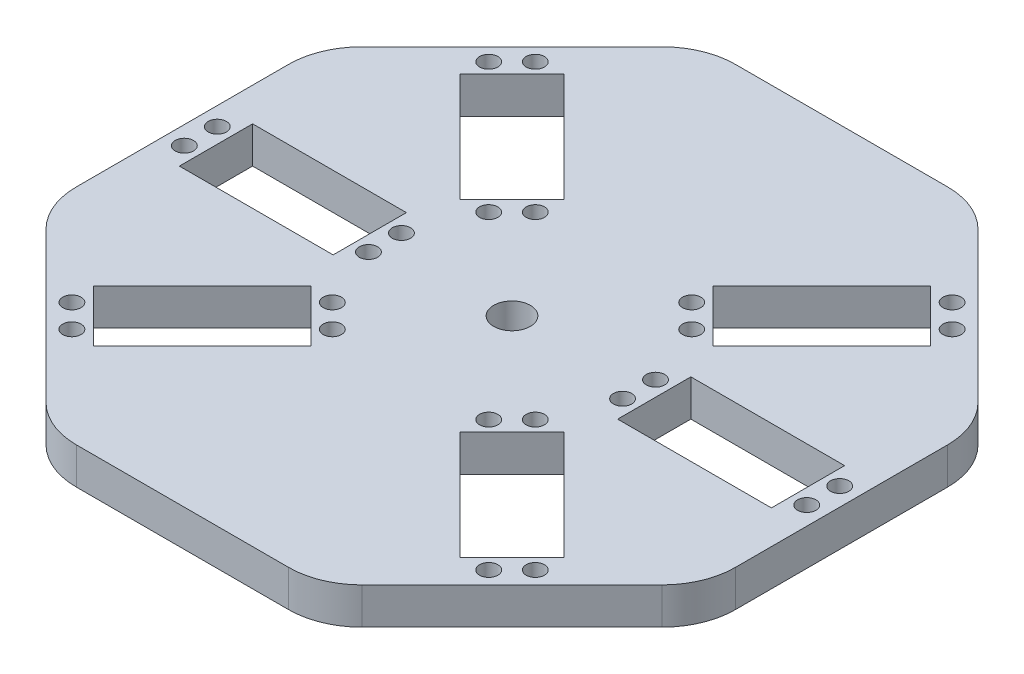
from build123d import *

# Parameters (mm, degrees)
SKETCH1_R           = 2.5
SKETCH1_W           = 42
SKETCH1_H           = 20
BOSS_EXTRUDE1_DEPTH = 10
FILLET1_R           = 20
SKETCH2_R           = 5
CUT_EXTRUDE1_DEPTH  = 128.671453348


with BuildPart() as part:
    # Sketch1 → Boss-Extrude1 (new body)
    with BuildSketch(Plane(origin=(0, 0, 0), x_dir=(1, 0, 0), z_dir=(0, 1, 0))):
        Polygon((-90, -37.279220614), (-37.279220614, -90), (37.279220614, -90), (90, -37.279220614), (90, 37.279220614), (37.279220614, 90), (-37.279220614, 90), (-90, 37.279220614), align=None)
        with Locations(Location((56.922095886, -63.286056916, 0), (0, 0, 270))):
            Circle(SKETCH1_R, mode=Mode.SUBTRACT)
        with Locations(Location((63.286056916, -56.922095886, 0), (0, 0, 270))):
            Circle(SKETCH1_R, mode=Mode.SUBTRACT)
        with Locations(Location((27.718585823, -21.354624792, 0), (0, 0, 270))):
            Circle(SKETCH1_R, mode=Mode.SUBTRACT)
        with Locations(Location((21.354624792, -27.718585823, 0), (0, 0, 270))):
            Circle(SKETCH1_R, mode=Mode.SUBTRACT)
        with Locations(Location((-27.718585823, -21.354624792, 0), (0, 0, 270))):
            Circle(SKETCH1_R, mode=Mode.SUBTRACT)
        with Locations(Location((-21.354624792, -27.718585823, 0), (0, 0, 270))):
            Circle(SKETCH1_R, mode=Mode.SUBTRACT)
        with Locations(Location((-56.922095886, -63.286056916, 0), (0, 0, 270))):
            Circle(SKETCH1_R, mode=Mode.SUBTRACT)
        with Locations(Location((-63.286056916, -56.922095886, 0), (0, 0, 270))):
            Circle(SKETCH1_R, mode=Mode.SUBTRACT)
        with Locations(Location((-34.7, 4.5, 0), (0, 0, 270))):
            Circle(SKETCH1_R, mode=Mode.SUBTRACT)
        with Locations(Location((-34.7, -4.5, 0), (0, 0, 270))):
            Circle(SKETCH1_R, mode=Mode.SUBTRACT)
        with Locations(Location((-85, -4.5, 0), (0, 0, 270))):
            Circle(SKETCH1_R, mode=Mode.SUBTRACT)
        with Locations(Location((-85, 4.5, 0), (0, 0, 270))):
            Circle(SKETCH1_R, mode=Mode.SUBTRACT)
        with Locations(Location((-21.354624792, 27.718585823, 0), (0, 0, 270))):
            Circle(SKETCH1_R, mode=Mode.SUBTRACT)
        with Locations(Location((-27.718585823, 21.354624792, 0), (0, 0, 270))):
            Circle(SKETCH1_R, mode=Mode.SUBTRACT)
        with Locations(Location((-63.286056916, 56.922095886, 0), (0, 0, 270))):
            Circle(SKETCH1_R, mode=Mode.SUBTRACT)
        with Locations(Location((-56.922095886, 63.286056916, 0), (0, 0, 270))):
            Circle(SKETCH1_R, mode=Mode.SUBTRACT)
        with Locations(Location((27.718585823, 21.354624792, 0), (0, 0, 270))):
            Circle(SKETCH1_R, mode=Mode.SUBTRACT)
        with Locations(Location((21.354624792, 27.718585823, 0), (0, 0, 270))):
            Circle(SKETCH1_R, mode=Mode.SUBTRACT)
        with Locations(Location((56.922095886, 63.286056916, 0), (0, 0, 270))):
            Circle(SKETCH1_R, mode=Mode.SUBTRACT)
        with Locations(Location((63.286056916, 56.922095886, 0), (0, 0, 270))):
            Circle(SKETCH1_R, mode=Mode.SUBTRACT)
        with Locations(Location((34.7, -4.5, 0), (0, 0, 270))):
            Circle(SKETCH1_R, mode=Mode.SUBTRACT)
        with Locations(Location((34.7, 4.5, 0), (0, 0, 270))):
            Circle(SKETCH1_R, mode=Mode.SUBTRACT)
        with Locations(Location((85, 4.5, 0), (0, 0, 270))):
            Circle(SKETCH1_R, mode=Mode.SUBTRACT)
        with Locations(Location((85, -4.5, 0), (0, 0, 270))):
            Circle(SKETCH1_R, mode=Mode.SUBTRACT)
        Polygon((34.542166261, -20.400030637), (20.400030637, -34.542166261), (50.098515447, -64.240651071), (64.240651071, -50.098515447), align=None, mode=Mode.SUBTRACT)
        Polygon((-20.400030637, -34.542166261), (-34.542166261, -20.400030637), (-64.240651071, -50.098515447), (-50.098515447, -64.240651071), align=None, mode=Mode.SUBTRACT)
        with Locations((-59.85, 0)):
            Rectangle(SKETCH1_W, SKETCH1_H, mode=Mode.SUBTRACT)
        Polygon((-34.542166261, 20.400030637), (-20.400030637, 34.542166261), (-50.098515447, 64.240651071), (-64.240651071, 50.098515447), align=None, mode=Mode.SUBTRACT)
        Polygon((20.400030637, 34.542166261), (34.542166261, 20.400030637), (64.240651071, 50.098515447), (50.098515447, 64.240651071), align=None, mode=Mode.SUBTRACT)
        with Locations((59.85, 0)):
            Rectangle(SKETCH1_W, SKETCH1_H, mode=Mode.SUBTRACT)
    extrude(amount=BOSS_EXTRUDE1_DEPTH)

    # Fillet1
    fillet1_edges = [part.edges().sort_by_distance(p)[0] for p in [
        (-37.279220614, 5, -90),
        (37.279220614, 5, -90),
        (90, 5, -37.279220614),
        (90, 5, 37.279220614),
        (37.279220614, 5, 90),
        (-37.279220614, 5, 90),
        (-90, 5, 37.279220614),
        (-90, 5, -37.279220614),
    ]]
    fillet(fillet1_edges, radius=FILLET1_R)

    # Sketch2 → Cut-Extrude1 (cut, through all)
    with BuildSketch(Plane(origin=(0, 10, 0), x_dir=(1, 0, 0), z_dir=(0, 1, 0))):
        with Locations(Location((0, 0, 0), (0, 0, 270))):
            Circle(SKETCH2_R)
    extrude(amount=-CUT_EXTRUDE1_DEPTH, mode=Mode.SUBTRACT)


solid = part.part
